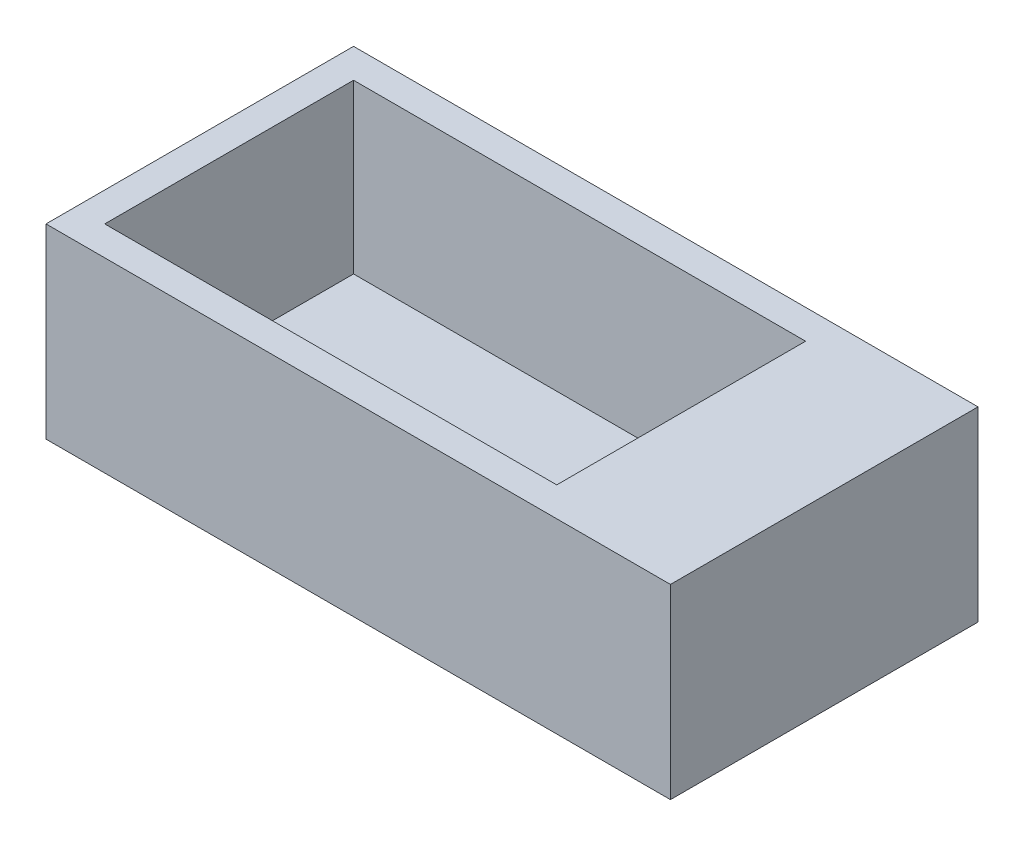
from build123d import *

# Parameters (mm, degrees)
ESBO_O1_W                = 67
ESBO_O1_H                = 33
ESBO_O1_W_2              = 60.7
ESBO_O1_H_2              = 26.7
ESBO_O1_W_3              = 12.2
RESSALTO_EXTRUS_O4_DEPTH = 20
ESBO_O3_W                = 48.5
ESBO_O3_H                = 26.7
RESSALTO_EXTRUS_O5_DEPTH = 2
RESSALTO_EXTRUS_O9_START = 18.15
ESBO_O4_R                = 3.9
ESBO_O4_R_2              = 2.83
RESSALTO_EXTRUS_O9_DEPTH = 2


with BuildPart() as part:
    # Esboço1 → Ressalto-extrusão4 (new body)
    # profile 1 of 2: a face of its own
    with BuildSketch(Plane(origin=(0, 0, 0), x_dir=(1, 0, 0), z_dir=(0, 1, 0))):
        Rectangle(ESBO_O1_W, ESBO_O1_H)
        Rectangle(ESBO_O1_W_2, ESBO_O1_H_2, mode=Mode.SUBTRACT)
    # profile 2 of 2: a face of its own
    with BuildSketch(Plane(origin=(0, 0, 0), x_dir=(1, 0, 0), z_dir=(0, 1, 0))):
        with Locations((24.25, 0)):
            Rectangle(ESBO_O1_W_3, ESBO_O1_H_2)
    extrude(amount=RESSALTO_EXTRUS_O4_DEPTH)

    # Esboço3 → Ressalto-extrusão5 (add)
    with BuildSketch(Plane(origin=(0, 0, 0), x_dir=(1, 0, 0), z_dir=(0, 1, 0))):
        with Locations((-6.1, 0)):
            Rectangle(ESBO_O3_W, ESBO_O3_H)
    extrude(amount=RESSALTO_EXTRUS_O5_DEPTH)

    # Esboço4 → Ressalto-extrusão9 (add)
    # profile 1 of 2: a face of its own
    with BuildSketch(Plane(origin=(0, 0, 0), x_dir=(0, 0, -1), z_dir=(1, 0, 0)).offset(RESSALTO_EXTRUS_O9_START)):
        with Locations((6.35, 10.75)):
            Circle(ESBO_O4_R)
        with Locations((6.35, 10.75)):
            Circle(ESBO_O4_R_2, mode=Mode.SUBTRACT)
    # profile 2 of 2: a face of its own
    with BuildSketch(Plane(origin=(0, 0, 0), x_dir=(0, 0, -1), z_dir=(1, 0, 0)).offset(RESSALTO_EXTRUS_O9_START)):
        with Locations((-6.35, 10.75)):
            Circle(ESBO_O4_R_2)
    extrude(amount=-RESSALTO_EXTRUS_O9_DEPTH)


solid = part.part
